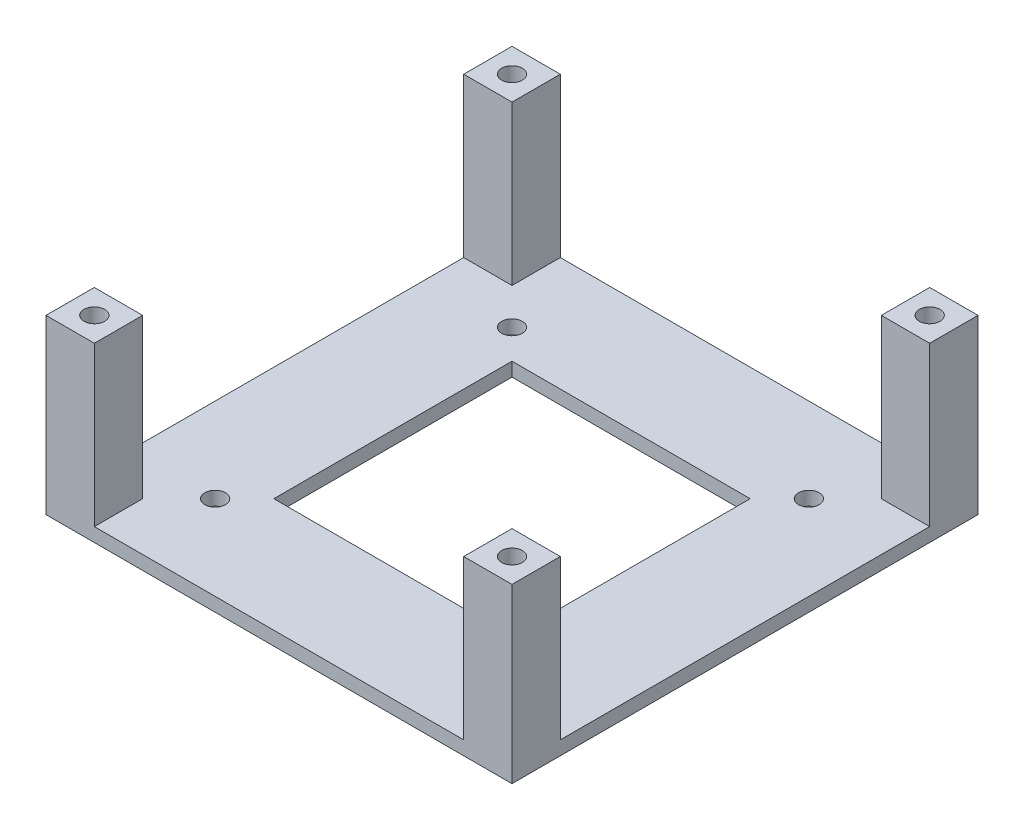
from build123d import *

# Parameters (mm, degrees)
SKETCH1_W           = 55.5
SKETCH1_H           = 55.5
SKETCH1_R           = 1.5
SKETCH1_W_2         = 34.5
SKETCH1_H_2         = 34.5
BOSS_EXTRUDE2_DEPTH = 2
SKETCH2_W           = 67.5
SKETCH2_H           = 67.5
SKETCH2_R           = 1.5
SKETCH2_W_2         = 55.5
SKETCH2_H_2         = 55.5
BOSS_EXTRUDE5_DEPTH = 2
SKETCH3_W           = 7
SKETCH3_H           = 7
SKETCH3_R           = 1.5
BOSS_EXTRUDE6_DEPTH = 25


with BuildPart() as part:
    # Sketch1 → Boss-Extrude2 (new body)
    with BuildSketch(Plane(origin=(0, 0, 0), x_dir=(1, 0, 0), z_dir=(0, 1, 0))):
        Rectangle(SKETCH1_W, SKETCH1_H)
        with Locations(Location((21.5, -21.5, 0), (0, 0, 270))):
            Circle(SKETCH1_R, mode=Mode.SUBTRACT)
        with Locations(Location((-21.5, -21.5, 0), (0, 0, 270))):
            Circle(SKETCH1_R, mode=Mode.SUBTRACT)
        with Locations(Location((21.5, 21.5, 0), (0, 0, 270))):
            Circle(SKETCH1_R, mode=Mode.SUBTRACT)
        with Locations(Location((-21.5, 21.5, 0), (0, 0, 270))):
            Circle(SKETCH1_R, mode=Mode.SUBTRACT)
        Rectangle(SKETCH1_W_2, SKETCH1_H_2, mode=Mode.SUBTRACT)
    extrude(amount=BOSS_EXTRUDE2_DEPTH)

    # Sketch2 → Boss-Extrude5 (add)
    with BuildSketch(Plane(origin=(0, 0, 0), x_dir=(1, 0, 0), z_dir=(0, 1, 0))):
        Rectangle(SKETCH2_W, SKETCH2_H)
        with Locations(Location((-30.25, 30.25, 0), (0, 0, 270))):
            Circle(SKETCH2_R, mode=Mode.SUBTRACT)
        with Locations(Location((30.25, 30.25, 0), (0, 0, 90))):
            Circle(SKETCH2_R, mode=Mode.SUBTRACT)
        with Locations(Location((30.25, -30.25, 0), (0, 0, 270))):
            Circle(SKETCH2_R, mode=Mode.SUBTRACT)
        with Locations(Location((-30.25, -30.25, 0), (0, 0, 90))):
            Circle(SKETCH2_R, mode=Mode.SUBTRACT)
        Rectangle(SKETCH2_W_2, SKETCH2_H_2, mode=Mode.SUBTRACT)
    extrude(amount=BOSS_EXTRUDE5_DEPTH)

    # Sketch3 → Boss-Extrude6 (add)
    # profile 1 of 4: a face of its own
    with BuildSketch(Plane(origin=(0, 0, 0), x_dir=(1, 0, 0), z_dir=(0, 1, 0))):
        with Locations((-30.25, -30.25)):
            Rectangle(SKETCH3_W, SKETCH3_H)
        with Locations(Location((-30.25, -30.25, 0), (0, 0, 90))):
            Circle(SKETCH3_R, mode=Mode.SUBTRACT)
    # profile 2 of 4: a face of its own
    with BuildSketch(Plane(origin=(0, 0, 0), x_dir=(1, 0, 0), z_dir=(0, 1, 0))):
        with Locations((30.25, -30.25)):
            Rectangle(SKETCH3_W, SKETCH3_H)
        with Locations(Location((30.25, -30.25, 0), (0, 0, 270))):
            Circle(SKETCH3_R, mode=Mode.SUBTRACT)
    # profile 3 of 4: a face of its own
    with BuildSketch(Plane(origin=(0, 0, 0), x_dir=(1, 0, 0), z_dir=(0, 1, 0))):
        with Locations((-30.25, 30.25)):
            Rectangle(SKETCH3_W, SKETCH3_H)
        with Locations(Location((-30.25, 30.25, 0), (0, 0, 270))):
            Circle(SKETCH3_R, mode=Mode.SUBTRACT)
    # profile 4 of 4: a face of its own
    with BuildSketch(Plane(origin=(0, 0, 0), x_dir=(1, 0, 0), z_dir=(0, 1, 0))):
        with Locations((30.25, 30.25)):
            Rectangle(SKETCH3_W, SKETCH3_H)
        with Locations(Location((30.25, 30.25, 0), (0, 0, 90))):
            Circle(SKETCH3_R, mode=Mode.SUBTRACT)
    extrude(amount=BOSS_EXTRUDE6_DEPTH)


solid = part.part
